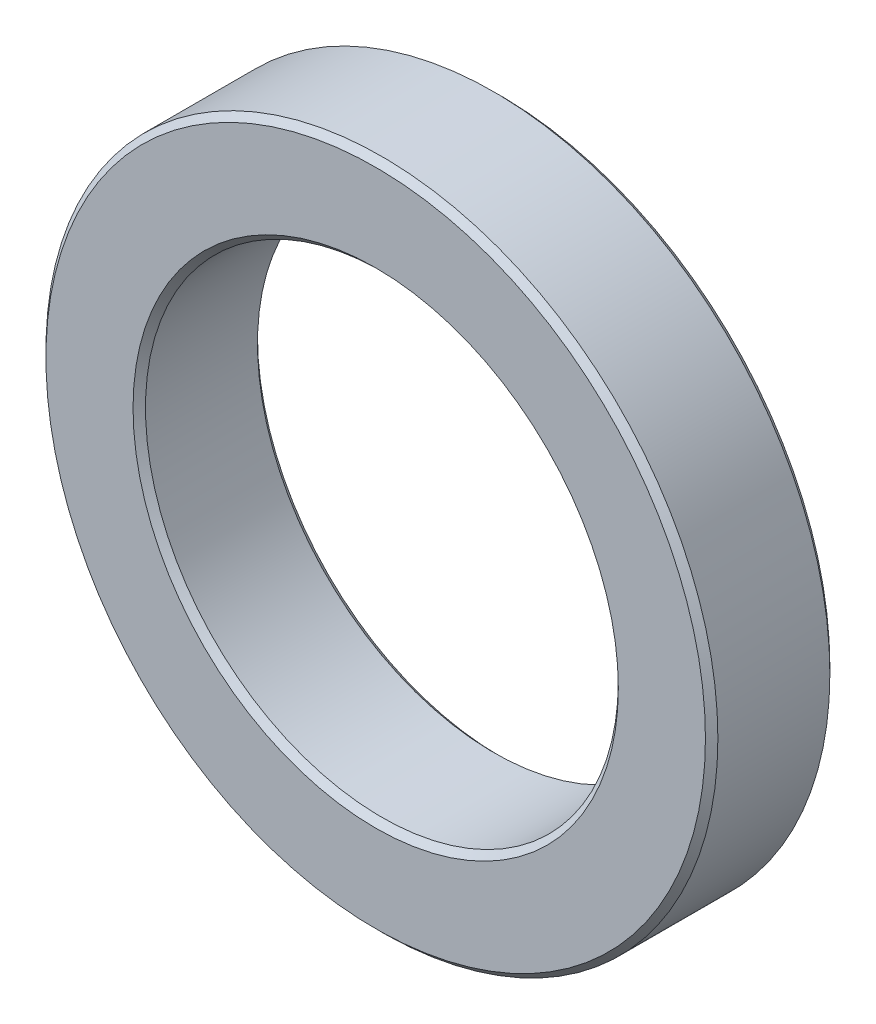
from build123d import *

# Parameters (mm, degrees)
SKIZZE1_R                       = 27
SKIZZE1_R_2                     = 19
AUFSATZ_LINEAR_AUSTRAGEN1_DEPTH = 5
FASE1_SIZE                      = 0.5


with BuildPart() as part:
    # Skizze1 → Aufsatz-Linear austragen1 (new, symmetric)
    with BuildSketch(Plane.XY):
        Circle(SKIZZE1_R)
        Circle(SKIZZE1_R_2, mode=Mode.SUBTRACT)
    extrude(amount=AUFSATZ_LINEAR_AUSTRAGEN1_DEPTH, both=True)

    # Fase1
    fase1_edges = [part.edges().sort_by_distance(p)[0] for p in [
        (-19, 0, -5),
        (-27, 0, -5),
        (-27, 0, 5),
        (-19, 0, 5),
    ]]
    chamfer(fase1_edges, length=FASE1_SIZE)


solid = part.part
